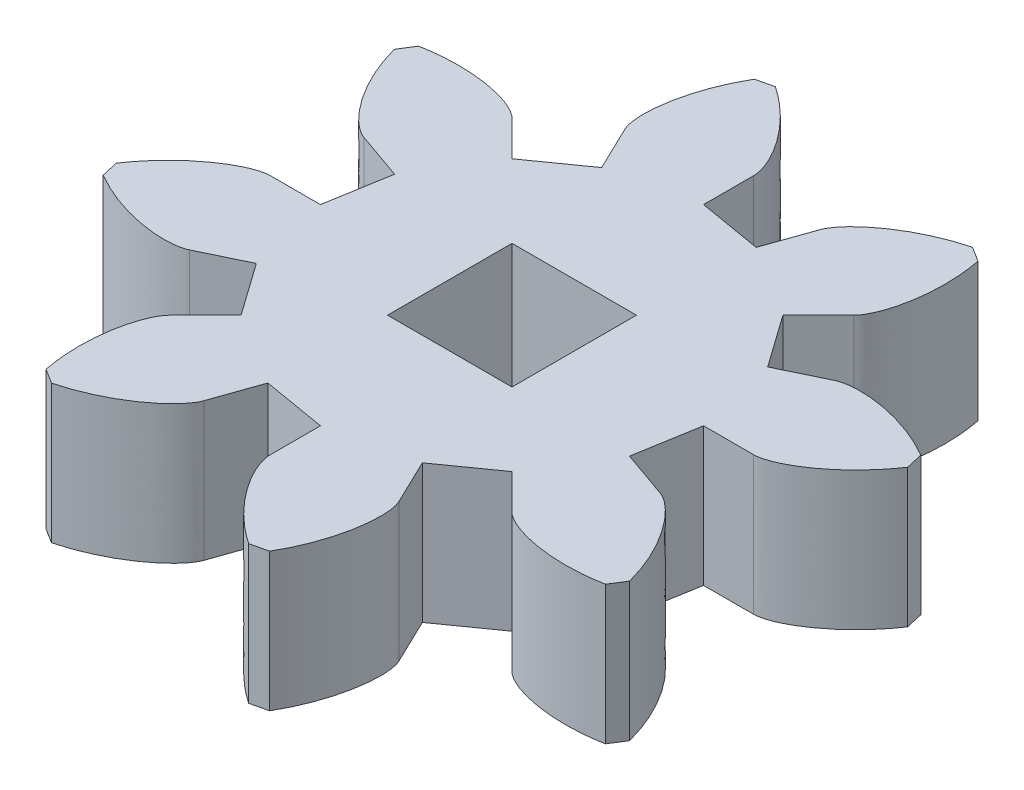
from build123d import *

# Parameters (mm, degrees)
BOSS_EXTRUDE1_DEPTH = 1.5
CIRPATTERN1_COUNT   = 8
SKETCH4_W           = 2.7
SKETCH4_H           = 2.7
CUT_EXTRUDE1_DEPTH  = 11.547606867


with BuildPart() as part:
    # Sketch5 → Boss-Extrude1 (new, symmetric)
    with BuildSketch(Plane(origin=(0, 0, 0), x_dir=(1, 0, 0), z_dir=(0, 1, 0))):
        with BuildLine():
            Line((0, 0), (3.342855658, 2.370565581))
            Line((3.342855658, 2.370565581), (3.746267067, 1.80169155))
            Line((3.746267067, 1.80169155), (4.726512919, 2.273109454))
            add(Edge.make_bspline(
                [(4.726512919, 2.273109454), (5.083840243, 2.444954607), (6.11501814, 2.361263688), (7.066052624, 1.805087159)],
                knots=[0, 0, 0, 0, 1, 1, 1, 1], degree=3))
            Line((7.066052624, 1.805087159), (7.108150593, 1.620429032))
            Line((7.108150593, 1.620429032), (7.150245001, 1.435770094))
            add(Edge.make_bspline(
                [(5.244706948, 7.012e-06), (5.641208616, 1.0552e-05), (6.534229602, 0.522356744), (7.150245001, 1.435770094)],
                knots=[0, 0, 0, 0, 1, 1, 1, 1], degree=3))
            Line((5.244706948, 7.012e-06), (4.156995234, -2.698e-06))
            Line((4.156995234, -2.698e-06), (4.039998902, -0.687512906))
            Line((4.039998902, -0.687512906), (0, 0))
        make_face()
    boss_extrude1 = extrude(amount=BOSS_EXTRUDE1_DEPTH, both=True)

    # CirPattern1: Boss-Extrude1 ×8 about axis
    cirpattern1_axis = Axis((0, -1.5, 0), (0, 1, 0))
    for i in range(1, CIRPATTERN1_COUNT):
        add(boss_extrude1.rotate(cirpattern1_axis, i * 360 / CIRPATTERN1_COUNT))

    # Sketch4 → Cut-Extrude1 (cut, through all)
    with BuildSketch(Plane(origin=(0, 1.5, 0), x_dir=(1, 0, 0), z_dir=(0, 1, 0))):
        Rectangle(SKETCH4_W, SKETCH4_H)
    extrude(amount=-CUT_EXTRUDE1_DEPTH, mode=Mode.SUBTRACT)


solid = part.part
